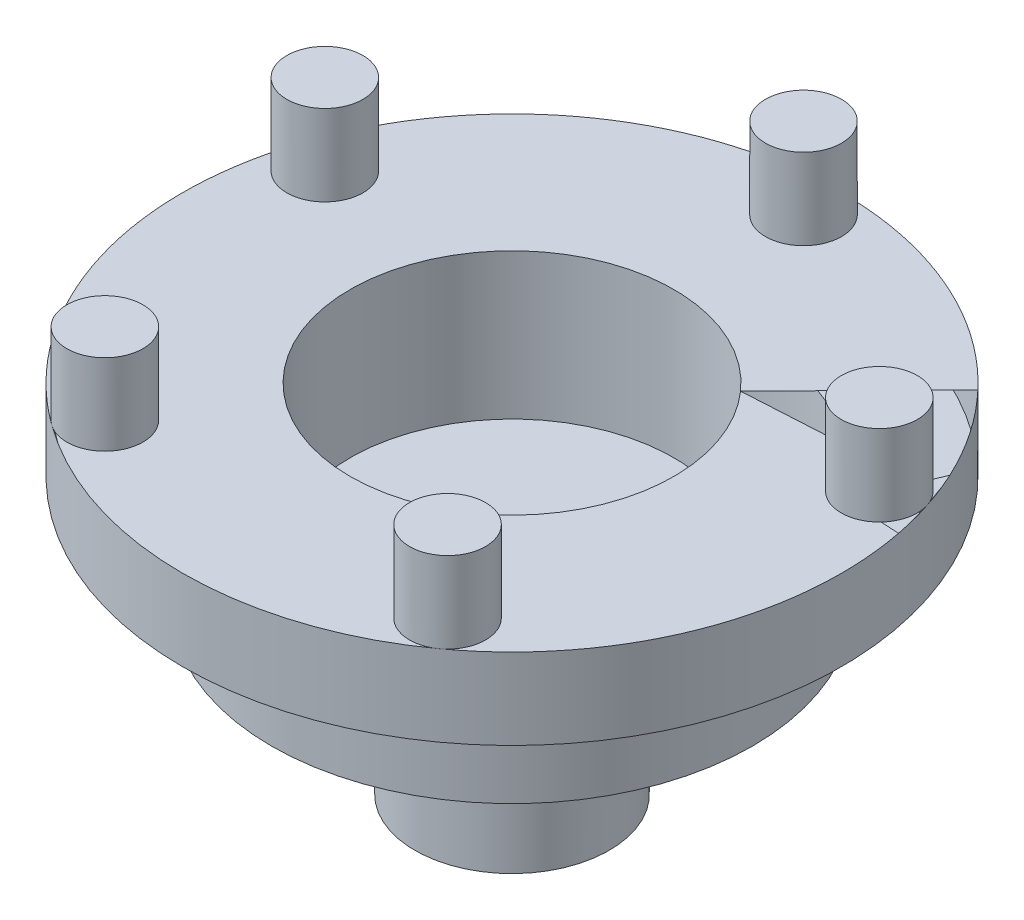
from build123d import *

# Parameters (mm, degrees)
SKETCH1_R               = 20.35
BOSS_EXTRUDE2_DEPTH     = 5
SKETCH1_3_R             = 2.35
BOSS_EXTRUDE3_DEPTH     = 10
SKETCH2_R               = 14.85
BOSS_EXTRUDE4_DEPTH     = 7
SKETCH3_R               = 6
SKETCH3_R_2             = 4.1
BOSS_EXTRUDE5_DEPTH     = 10
CUT_EXTRUDE1_DEPTH      = 34.425215033
CUT_EXTRUDE1_DEPTH_BACK = 34.425215033
SKETCH5_R               = 1.6
SKETCH6_R               = 10
CUT_EXTRUDE2_DEPTH      = 9


with BuildPart() as part:
    # Sketch1 → Boss-Extrude2 (new body)
    with BuildSketch(Plane(origin=(0, 0, 0), x_dir=(1, 0, 0), z_dir=(0, 1, 0))):
        Circle(SKETCH1_R)
    extrude(amount=BOSS_EXTRUDE2_DEPTH)

    # Sketch1<3> → Boss-Extrude3 (add)
    with BuildSketch(Plane(origin=(0, 0, 0), x_dir=(1, 0, 0), z_dir=(0, 1, 0))):
        with Locations((0, 18)):
            Circle(SKETCH1_3_R)
        with Locations((-17.119017293, 5.562305899)):
            Circle(SKETCH1_3_R)
        with Locations((-10.580134541, -14.562305899)):
            Circle(SKETCH1_3_R)
        with Locations((10.580134541, -14.562305899)):
            Circle(SKETCH1_3_R)
        with Locations((17.119017293, 5.562305899)):
            Circle(SKETCH1_3_R)
    extrude(amount=BOSS_EXTRUDE3_DEPTH)

    # Sketch2 → Boss-Extrude4 (add)
    with BuildSketch(Plane.XZ):
        Circle(SKETCH2_R)
    extrude(amount=BOSS_EXTRUDE4_DEPTH)

    # Sketch3 → Boss-Extrude5 (add)
    with BuildSketch(Plane.XZ.offset(7)):
        Circle(SKETCH3_R)
        Circle(SKETCH3_R_2, mode=Mode.SUBTRACT)
    extrude(amount=BOSS_EXTRUDE5_DEPTH)

    # Sketch5 → Cut-Extrude1 (cut, two sides: drawn at the far end of the back side and taken through both)
    with BuildSketch(Plane(origin=(0, 0, 0), x_dir=(0, 0, -1), z_dir=(1, 0, 0)).offset(-CUT_EXTRUDE1_DEPTH_BACK)):
        with Locations((0, -11.941738225)):
            Circle(SKETCH5_R)
    extrude(amount=CUT_EXTRUDE1_DEPTH + CUT_EXTRUDE1_DEPTH_BACK, mode=Mode.SUBTRACT)

    # Sketch6 → Cut-Extrude2 (cut)
    with BuildSketch(Plane(origin=(0, 5, 0), x_dir=(1, 0, 0), z_dir=(0, 1, 0))):
        Circle(SKETCH6_R)
    extrude(amount=-CUT_EXTRUDE2_DEPTH, mode=Mode.SUBTRACT)


solid = part.part
